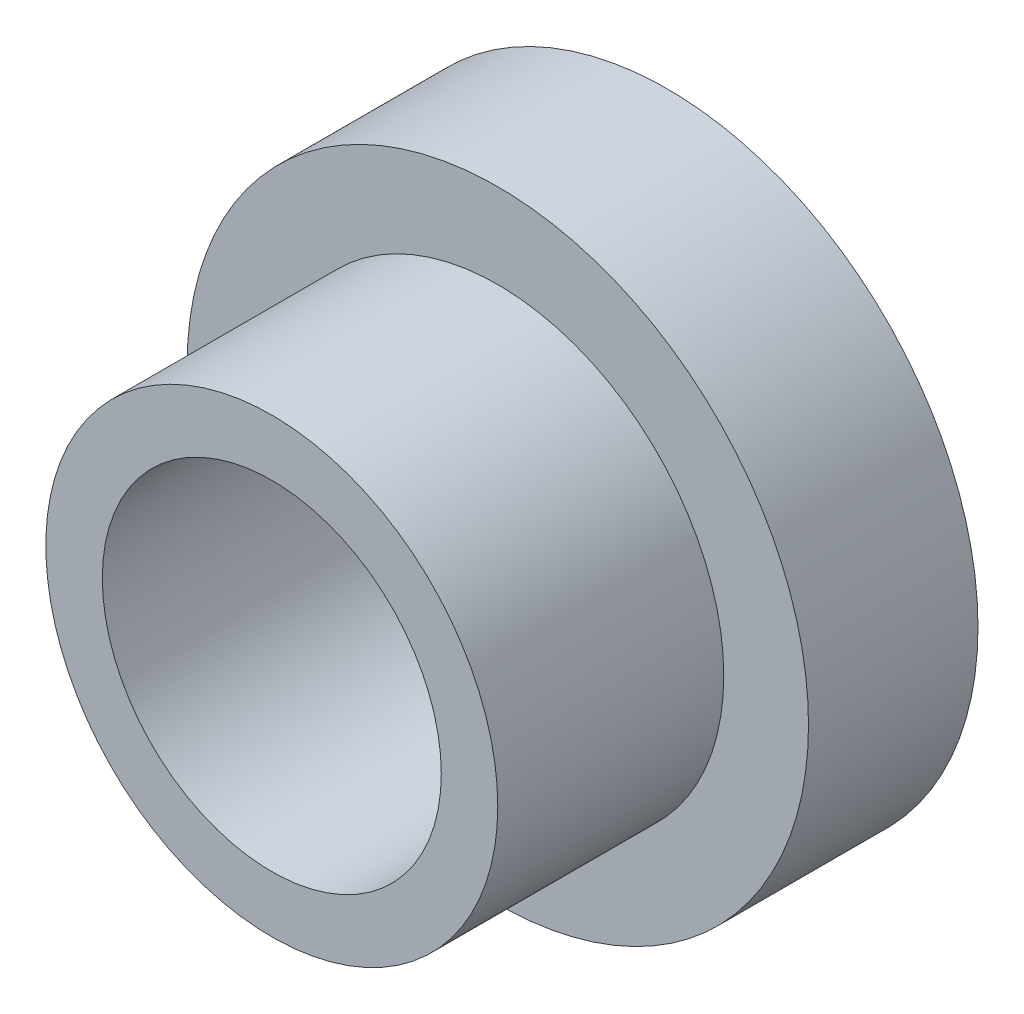
from build123d import *

# Parameters (mm, degrees)
SKETCH_1_R          = 5.5
EXTRUDE_174_DEPTH   = 3
SKETCH_2_R          = 4
EXTRUDE_1_DEPTH     = 4
SKETCH_3_R          = 3
CUT_EXTRUDE_1_DEPTH = 11.464224768


with BuildPart() as part:
    # Эскиз1 → Extrude 174 (new body)
    with BuildSketch(Plane.XY):
        Circle(SKETCH_1_R)
    extrude(amount=EXTRUDE_174_DEPTH)

    # Эскиз2 → Бобышка-Вытянуть1 (add)
    with BuildSketch(Plane.XY.offset(3)):
        Circle(SKETCH_2_R)
    extrude(amount=EXTRUDE_1_DEPTH)

    # Эскиз3 → Вырез-Вытянуть1 (cut, through all)
    with BuildSketch(Plane.XY.offset(7)):
        Circle(SKETCH_3_R)
    extrude(amount=-CUT_EXTRUDE_1_DEPTH, mode=Mode.SUBTRACT)


solid = part.part
